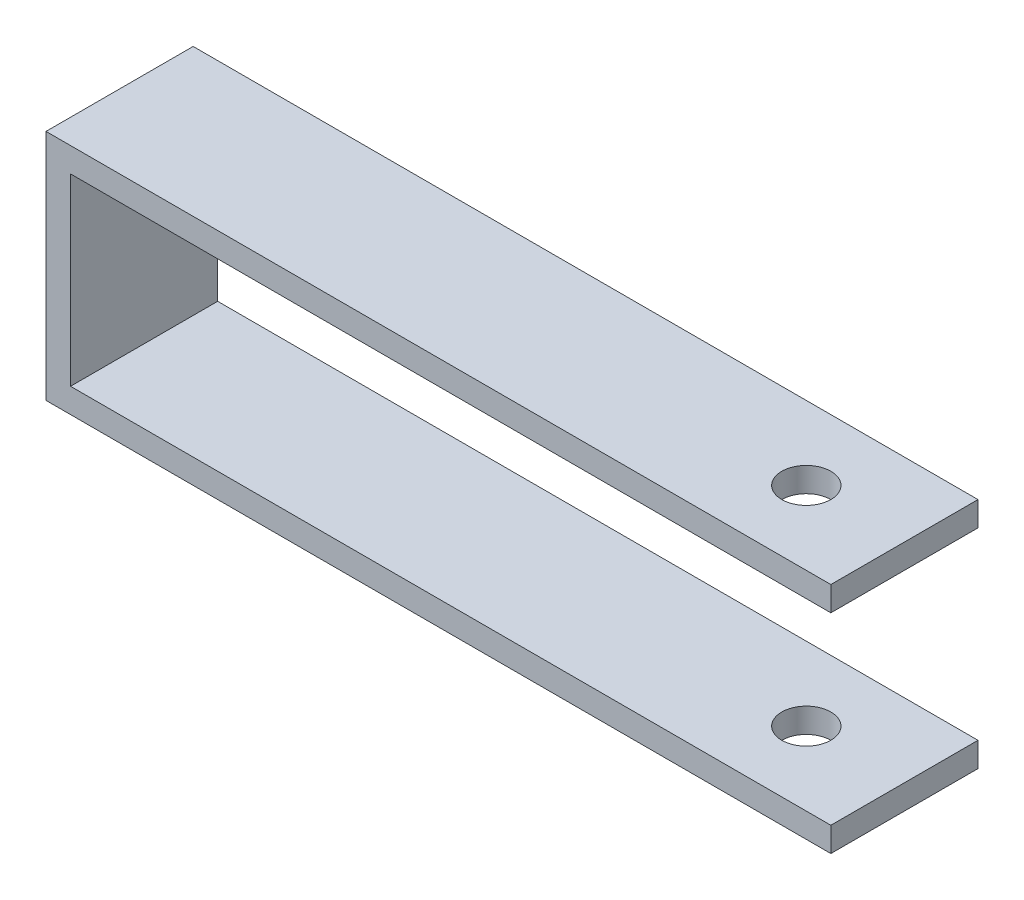
from build123d import *

# Parameters (mm, degrees)
SKETCH1_W           = 101.6
SKETCH1_H           = 19.05
BOSS_EXTRUDE1_DEPTH = 3.175
SKETCH5_R           = 3.175
CUT_EXTRUDE2_DEPTH  = 160.51127542
SKETCH6_W           = 101.6
SKETCH6_H           = 19.05
SKETCH6_R           = 3.175
BOSS_EXTRUDE2_DEPTH = 3.175
SKETCH9_W           = 19.05
SKETCH9_H           = 30.1625
BOSS_EXTRUDE5_DEPTH = 3.175


with BuildPart() as part:
    # Sketch1 → Boss-Extrude1 (new body)
    with BuildSketch(Plane(origin=(0, 0, 0), x_dir=(1, 0, 0), z_dir=(0, 1, 0))):
        with Locations((-104.742582317, 25.692487805)):
            Rectangle(SKETCH1_W, SKETCH1_H)
    extrude(amount=BOSS_EXTRUDE1_DEPTH)

    # Sketch5 → Cut-Extrude2 (cut, through all)
    with BuildSketch(Plane(origin=(0, 3.175, 0), x_dir=(1, 0, 0), z_dir=(0, 1, 0))):
        with Locations(Location((-66.642582317, 25.692487805, 0), (0, 0, 270))):
            Circle(SKETCH5_R)
    extrude(amount=-CUT_EXTRUDE2_DEPTH, mode=Mode.SUBTRACT)



with BuildPart() as body_2:
    # Sketch6 → Boss-Extrude2 (new body)
    with BuildSketch(Plane(origin=(0, 26.9875, 0), x_dir=(1, 0, 0), z_dir=(0, 1, 0))):
        with Locations((-104.742582317, 25.692487805)):
            Rectangle(SKETCH6_W, SKETCH6_H)
        with Locations(Location((-66.642582317, 25.692487805, 0), (0, 0, 270))):
            Circle(SKETCH6_R, mode=Mode.SUBTRACT)
    extrude(amount=BOSS_EXTRUDE2_DEPTH)


with BuildPart() as part_1:
    add(part.part)

    add(body_2.part)  # Boss-Extrude5 merges body 2
    # Sketch9 → Boss-Extrude5 (add)
    with BuildSketch(Plane.ZY.offset(155.542582317)):
        with Locations((-25.692487805, 15.08125)):
            Rectangle(SKETCH9_W, SKETCH9_H)
    extrude(amount=-BOSS_EXTRUDE5_DEPTH)


solid = part_1.part
